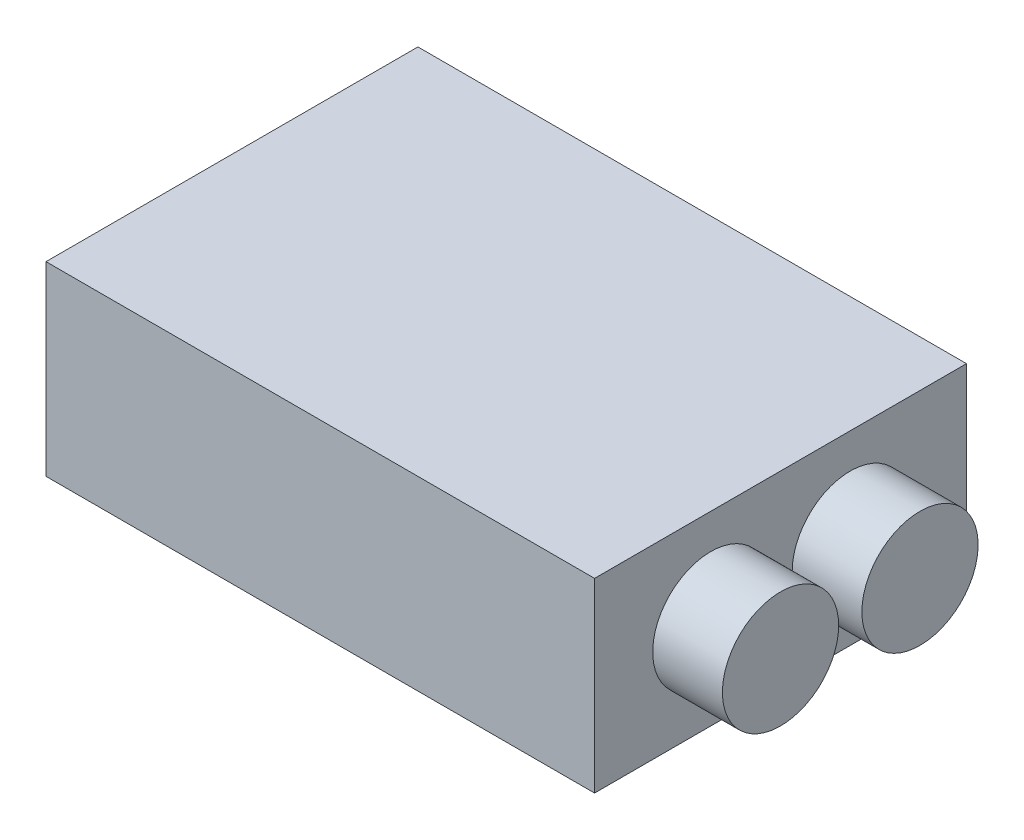
from build123d import *

# Parameters (mm, degrees)
SKETCH2_W           = 118
SKETCH2_H           = 80
BOSS_EXTRUDE1_DEPTH = 40
SKETCH3_R           = 12.5
BOSS_EXTRUDE2_DEPTH = 15


with BuildPart() as part:
    # Sketch2 → Boss-Extrude1 (new body)
    with BuildSketch(Plane(origin=(0, 0, 0), x_dir=(1, 0, 0), z_dir=(0, 1, 0))):
        with Locations((59, -40)):
            Rectangle(SKETCH2_W, SKETCH2_H)
    extrude(amount=BOSS_EXTRUDE1_DEPTH)

    # Sketch3 → Boss-Extrude2 (add)
    with BuildSketch(Plane(origin=(118, 0, 0), x_dir=(0, 0, -1), z_dir=(1, 0, 0))):
        with Locations((-55, 20)):
            Circle(SKETCH3_R)
        with Locations(Location((-25, 20, 0), (0, 0, 180))):
            Circle(SKETCH3_R)
    extrude(amount=BOSS_EXTRUDE2_DEPTH)


solid = part.part
